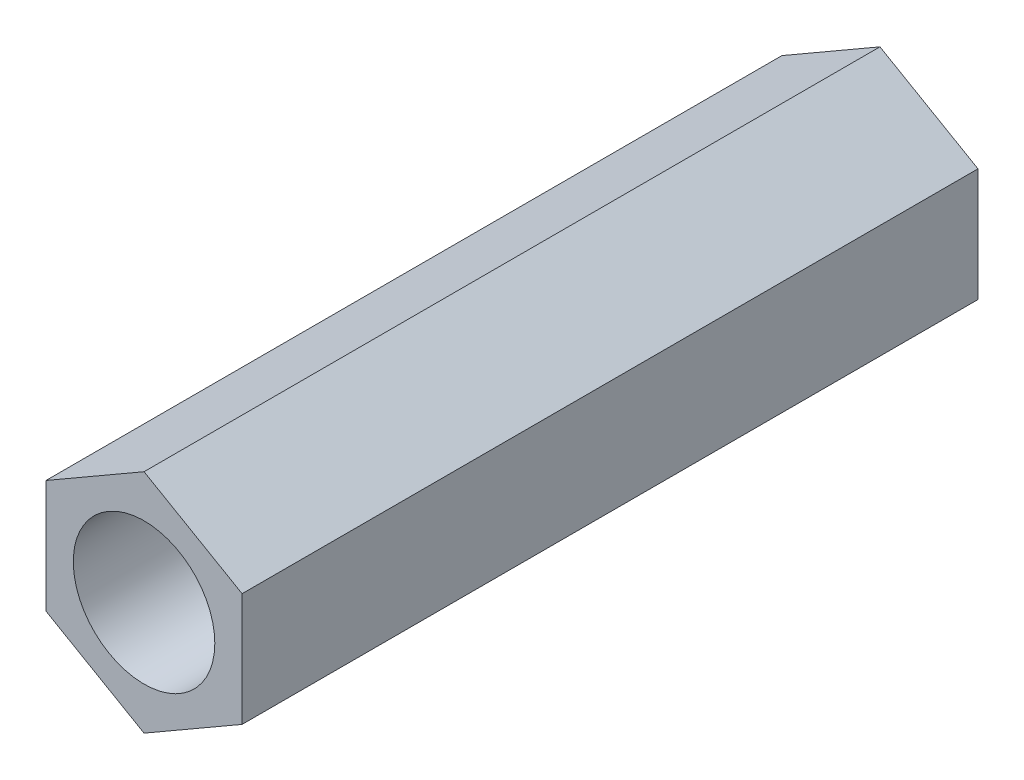
from build123d import *

# Parameters (mm, degrees)
SKETCH1_R           = 63.5
BOSS_EXTRUDE1_DEPTH = 660.4


with BuildPart() as part:
    # Sketch1 → Boss-Extrude1 (new body)
    with BuildSketch(Plane.XY):
        Polygon((0, 101.6), (87.988181024, 50.8), (87.988181024, -50.8), (0, -101.6), (-87.988181024, -50.8), (-87.988181024, 50.8), align=None)
        Circle(SKETCH1_R, mode=Mode.SUBTRACT)
    extrude(amount=BOSS_EXTRUDE1_DEPTH)


solid = part.part
